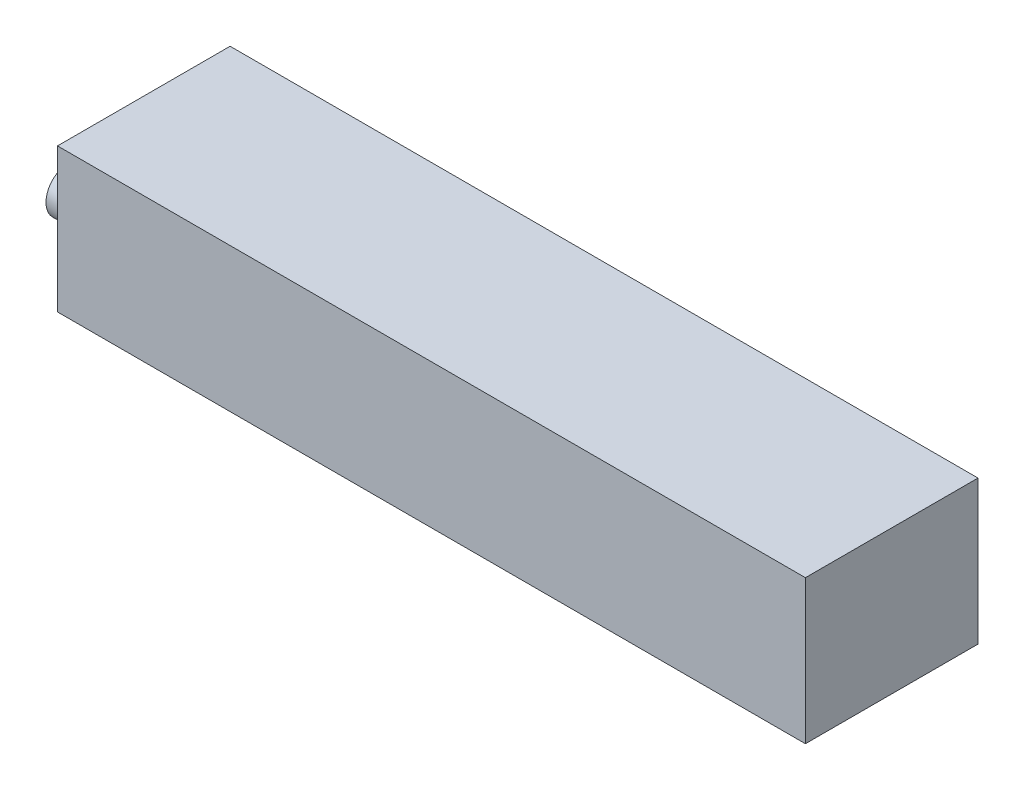
from build123d import *

# Parameters (mm, degrees)
SKETCH_1_W      = 130
SKETCH_1_H      = 30
EXTRUDE_1_DEPTH = 25
SKETCH_2_R      = 4
EXTRUDE_2_DEPTH = 5


with BuildPart() as part:
    # 草图1 → 凸台-拉伸1 (new body)
    with BuildSketch(Plane(origin=(0, 0, 0), x_dir=(1, 0, 0), z_dir=(0, 1, 0))):
        Rectangle(SKETCH_1_W, SKETCH_1_H)
    extrude(amount=EXTRUDE_1_DEPTH)

    # 草图2 → 凸台-拉伸2 (add)
    with BuildSketch(Plane.ZY.offset(65)):
        with Locations(Location((-8, 12.5, 0), (0, 0, 180))):
            Circle(SKETCH_2_R)
        with Locations(Location((8, 12.5, 0), (0, 0, 180))):
            Circle(SKETCH_2_R)
    extrude(amount=EXTRUDE_2_DEPTH)


solid = part.part
